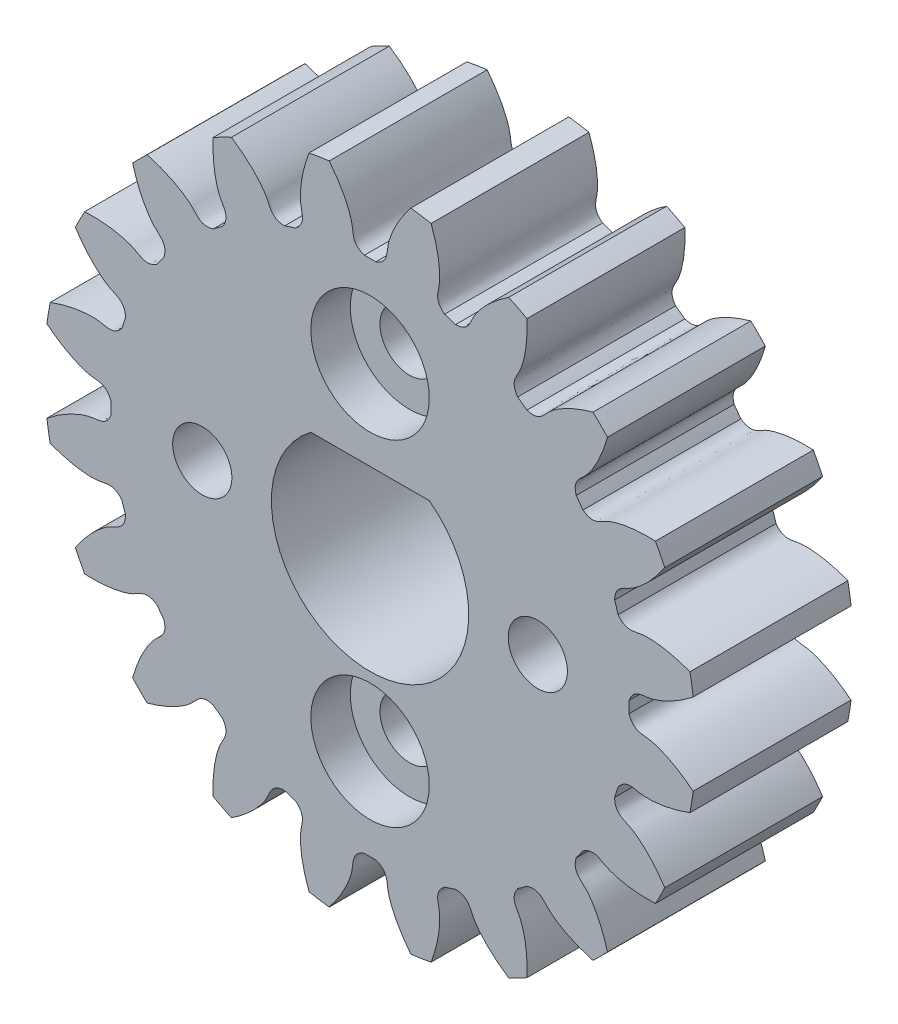
from build123d import *

# Parameters (mm, degrees)
SKETCH_1_R               = 16.5
EXTRUDE_1_DEPTH          = 8
CUT_EXTRUDE_1_DEPTH      = 25.667792767
PATTERN_CIRCULAR_1_COUNT = 20
SKETCH_4_R               = 1.5
CUT_EXTRUDE_2_DEPTH      = 10
SKETCH_5_R               = 3
CUT_EXTRUDE_3_DEPTH      = 2


with BuildPart() as part:
    # 草图1 → 凸台-拉伸1 (new body)
    with BuildSketch(Plane.XY):
        Circle(SKETCH_1_R)
    extrude(amount=EXTRUDE_1_DEPTH)

    # 草图2 → 切除-拉伸1 (cut, through all)
    with BuildSketch(Plane.XY):
        with BuildLine():
            ThreePointArc((0.289974901, 13.121796354), (0, 13.125), (-0.289974901, 13.121796354))
            add(Edge.make_bspline(
                [(-0.289974901, 13.121796354), (-0.916784107, 13.340213268), (-0.835626149, 13.780670548), (-0.919345585, 14.205014104), (-0.928338279, 14.246334921), (-0.939466335, 14.292951923), (-0.952938145, 14.344795254), (-0.96896871, 14.401787245), (-0.987768083, 14.463844242), (-1.009544807, 14.5308761), (-1.034504625, 14.602786421), (-1.06285065, 14.679472568), (-1.094783098, 14.760825751), (-1.130499153, 14.846731096), (-1.170192797, 14.937067727), (-1.214054647, 15.031708847), (-1.2622718, 15.130521826), (-1.315027675, 15.233368292), (-1.372501858, 15.340104225), (-1.434869948, 15.450580056), (-1.502303414, 15.564640771), (-1.574969439, 15.682126017), (-1.653030782, 15.802870208), (-1.736645634, 15.926702646), (-1.825967477, 16.05344763), (-1.921144951, 16.182924586), (-2.022321721, 16.314948181), (-2.129636342, 16.449328459), (-2.24322214, 16.585870967), (-2.363207078, 16.724376892), (-2.489713645, 16.864643194), (-2.622858733, 17.006462752), (-2.762753527, 17.149624504), (-2.909503389, 17.29391359), (-3.06320776, 17.439111509), (-3.223960048, 17.584996263), (-3.391847534, 17.731342516), (-3.566951278, 17.877921749), (-3.749346018, 18.024502419), (-3.939100102, 18.170850122), (-4.136275349, 18.31672776), (-4.412210386, 18.512459802), (-4.625898619, 18.654498902), (-4.771736973, 18.747377789)],
                knots=[0, 0, 0, 0, 0.165916003, 0.170905922, 0.176663519, 0.183188797, 0.190481754, 0.198542391, 0.207370708, 0.216966704, 0.22733038, 0.238461736, 0.250360771, 0.263027487, 0.276461881, 0.290663956, 0.30563371, 0.321371144, 0.337876258, 0.355149051, 0.373189524, 0.391997677, 0.411573509, 0.431917021, 0.453028213, 0.474907084, 0.497553636, 0.520967867, 0.545149777, 0.570099367, 0.595816637, 0.622301587, 0.649554216, 0.677574526, 0.706362514, 0.735918183, 0.766241531, 0.797332559, 0.829191267, 0.861817654, 0.895211721, 0.929373468, 1, 1, 1, 1], degree=3))
            ThreePointArc((-4.771736973, 18.747377789), (0, 19.345119481), (4.771736973, 18.747377789))
            add(Edge.make_bspline(
                [(0.289974901, 13.121796354), (0.916784107, 13.340213268), (0.835626149, 13.780670548), (0.919345585, 14.205014104), (0.928338279, 14.246334921), (0.939466335, 14.292951923), (0.952938145, 14.344795254), (0.96896871, 14.401787245), (0.987768083, 14.463844242), (1.009544807, 14.5308761), (1.034504625, 14.602786421), (1.06285065, 14.679472568), (1.094783098, 14.760825751), (1.130499153, 14.846731096), (1.170192797, 14.937067727), (1.214054647, 15.031708847), (1.2622718, 15.130521826), (1.315027675, 15.233368292), (1.372501858, 15.340104225), (1.434869948, 15.450580056), (1.502303414, 15.564640771), (1.574969439, 15.682126017), (1.653030782, 15.802870208), (1.736645634, 15.926702646), (1.825967477, 16.05344763), (1.921144951, 16.182924586), (2.022321721, 16.314948181), (2.129636342, 16.449328459), (2.24322214, 16.585870967), (2.363207078, 16.724376892), (2.489713645, 16.864643194), (2.622858733, 17.006462752), (2.762753527, 17.149624504), (2.909503389, 17.29391359), (3.06320776, 17.439111509), (3.223960048, 17.584996263), (3.391847534, 17.731342516), (3.566951278, 17.877921749), (3.749346018, 18.024502419), (3.939100102, 18.170850122), (4.136275349, 18.31672776), (4.412210386, 18.512459802), (4.625898619, 18.654498902), (4.771736973, 18.747377789)],
                knots=[0, 0, 0, 0, 0.165916003, 0.170905922, 0.176663519, 0.183188797, 0.190481754, 0.198542391, 0.207370708, 0.216966704, 0.22733038, 0.238461736, 0.250360771, 0.263027487, 0.276461881, 0.290663956, 0.30563371, 0.321371144, 0.337876258, 0.355149051, 0.373189524, 0.391997677, 0.411573509, 0.431917021, 0.453028213, 0.474907084, 0.497553636, 0.520967867, 0.545149777, 0.570099367, 0.595816637, 0.622301587, 0.649554216, 0.677574526, 0.706362514, 0.735918183, 0.766241531, 0.797332559, 0.829191267, 0.861817654, 0.895211721, 0.929373468, 1, 1, 1, 1], degree=3))
        make_face()
    cut_extrude_1 = extrude(amount=CUT_EXTRUDE_1_DEPTH, mode=Mode.SUBTRACT)

    # 阵列(圆周)1: 切除-拉伸1 ×20 about axis
    pattern_circular_1_axis = Axis((0, 0, 8), (0, 0, -1))
    for i in range(1, PATTERN_CIRCULAR_1_COUNT):
        add(cut_extrude_1.rotate(pattern_circular_1_axis, i * 360 / PATTERN_CIRCULAR_1_COUNT), mode=Mode.SUBTRACT)

    # 草图4 → 切除-拉伸2 (cut)
    with BuildSketch(Plane.XY.offset(8)):
        with Locations((0, 8.5)):
            Circle(SKETCH_4_R)
        with Locations((8.5, 0)):
            Circle(SKETCH_4_R)
        with Locations((0, -8.5)):
            Circle(SKETCH_4_R)
        with Locations((-8.5, 0)):
            Circle(SKETCH_4_R)
        with BuildLine():
            Line((-3, 4), (3, 4))
            ThreePointArc((3, 4), (0, -5), (-3, 4))
        make_face()
    extrude(amount=-CUT_EXTRUDE_2_DEPTH, mode=Mode.SUBTRACT)

    # 草图5 → 切除-拉伸3 (cut)
    with BuildSketch(Plane.XY.offset(8)):
        with Locations((0, 8.5)):
            Circle(SKETCH_5_R)
        with Locations((0, -8.5)):
            Circle(SKETCH_5_R)
    extrude(amount=-CUT_EXTRUDE_3_DEPTH, mode=Mode.SUBTRACT)


solid = part.part
